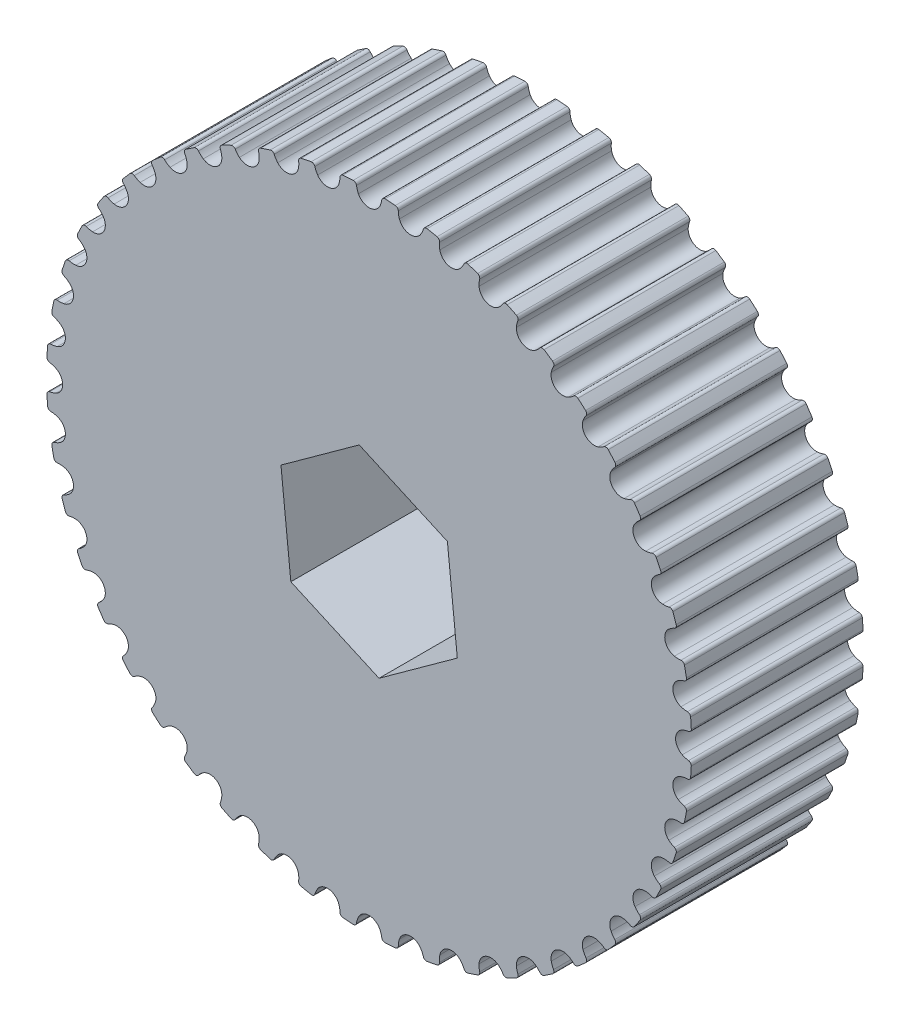
from build123d import *

# Parameters (mm, degrees)
SKETCH2_W          = 8
SKETCH2_H          = 15.024
CUT_EXTRUDE1_REACH = 27.62
CUT_EXTRUDE1_START = 4
CIRPATTERN1_COUNT  = 48
CUT_EXTRUDE2_REACH = 24.679


with BuildPart() as part:
    # Sketch2 → Revolve1 (revolve)
    with BuildSketch(Plane(origin=(0, 0, 0), x_dir=(0, 0, -1), z_dir=(1, 0, 0))):
        with Locations((0, 7.512)):
            Rectangle(SKETCH2_W, SKETCH2_H)
    revolve(axis=Axis((0, 0, 4), (0, 0, -1)))

    # Sketch3 → Cut-Extrude1 (cut, up to next)
    with BuildSketch(Plane.XY.offset(CUT_EXTRUDE1_START), mode=Mode.PRIVATE) as cut_extrude1_sk1:
        with BuildLine():
            Line((2.012958957, 15.278), (-2.413874101, 15.278))
            Line((-2.413874101, 15.278), (-2.126595061, 14.872732414))
            ThreePointArc((-2.126595061, 14.872732414), (-1.43735999, 14.955085164), (-0.745056706, 15.005514537))
            ThreePointArc((-0.745056706, 15.005514537), (-0.642467051, 14.971657231), (-0.589233079, 14.877651388))
            ThreePointArc((-0.589233079, 14.877651388), (-0.55526645, 14.728253472), (-0.498876404, 14.585797753))
            ThreePointArc((-0.498876404, 14.585797753), (0, 14.274), (0.498876404, 14.585797753))
            ThreePointArc((0.498876404, 14.585797753), (0.55526645, 14.728253472), (0.589233079, 14.877651388))
            ThreePointArc((0.589233079, 14.877651388), (0.642467051, 14.971657231), (0.745056706, 15.005514537))
            ThreePointArc((0.745056706, 15.005514537), (1.35491616, 14.962779762), (1.962532105, 14.895269173))
            Line((1.962532105, 14.895269173), (2.012958957, 15.278))
        make_face()
    cut_extrude1_tool1 = extrude(cut_extrude1_sk1.sketch, amount=-CUT_EXTRUDE1_REACH, mode=Mode.PRIVATE) & part.part
    cut_extrude1 = cut_extrude1_tool1.solids().sort_by_distance((-0.119958, 14.974375, 4))[0]
    add(cut_extrude1, mode=Mode.SUBTRACT)

    # CirPattern1: Cut-Extrude1 ×48 about axis
    cirpattern1_axis = Axis((0, 0, 4), (0, 0, 1))
    for i in range(1, CIRPATTERN1_COUNT):
        add(cut_extrude1.rotate(cirpattern1_axis, i * 360 / CIRPATTERN1_COUNT), mode=Mode.SUBTRACT)

    # Sketch4 → Cut-Extrude2 (cut, up to next)
    with BuildSketch(Plane.XY.offset(4), mode=Mode.PRIVATE) as cut_extrude2_sk1:
        Polygon((0.46101039, -4.476323203), (4.107114804, -1.838914893), (3.646104415, 2.63740831), (-0.46101039, 4.476323203), (-4.107114804, 1.838914893), (-3.646104415, -2.63740831), align=None)
    cut_extrude2_tool1 = extrude(cut_extrude2_sk1.sketch, amount=-CUT_EXTRUDE2_REACH, mode=Mode.PRIVATE) & part.part
    add(cut_extrude2_tool1.solids().sort_by_distance((0, 0, 4))[0], mode=Mode.SUBTRACT)


solid = part.part
